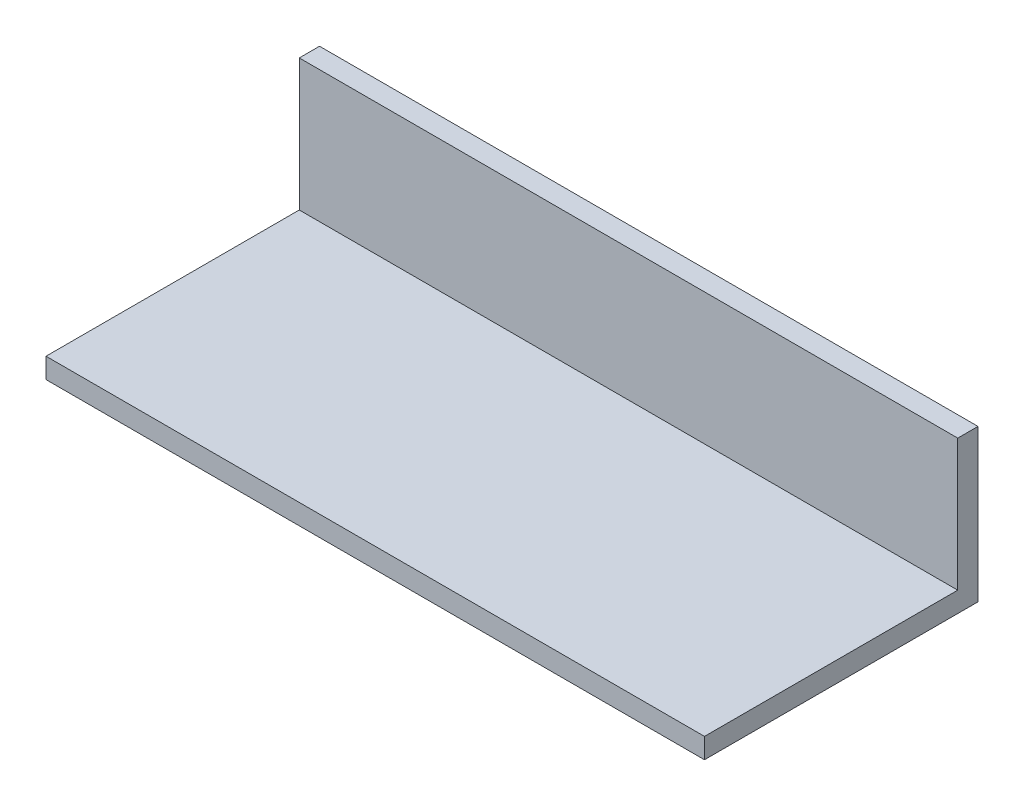
from build123d import *

# Parameters (mm, degrees)
ESQUISSE1_W        = 65
ESQUISSE1_H        = 25
BOSS_EXTRU_1_DEPTH = 2
ESQUISSE3_W        = 65
ESQUISSE3_H        = 15
BOSS_EXTRU_2_DEPTH = 2


with BuildPart() as part:
    # Esquisse1 → Boss.-Extru.1 (new body)
    with BuildSketch(Plane(origin=(0, 0, 0), x_dir=(1, 0, 0), z_dir=(0, 1, 0))):
        with Locations((8.839285714, -0.044642857)):
            Rectangle(ESQUISSE1_W, ESQUISSE1_H)
    extrude(amount=BOSS_EXTRU_1_DEPTH)

    # Esquisse3 → Boss.-Extru.2 (add)
    with BuildSketch(Plane(origin=(0, 0, -12.455357143), x_dir=(-1, 0, 0), z_dir=(0, 0, -1))):
        with Locations((-8.839285714, 7.5)):
            Rectangle(ESQUISSE3_W, ESQUISSE3_H)
    extrude(amount=BOSS_EXTRU_2_DEPTH)


solid = part.part
